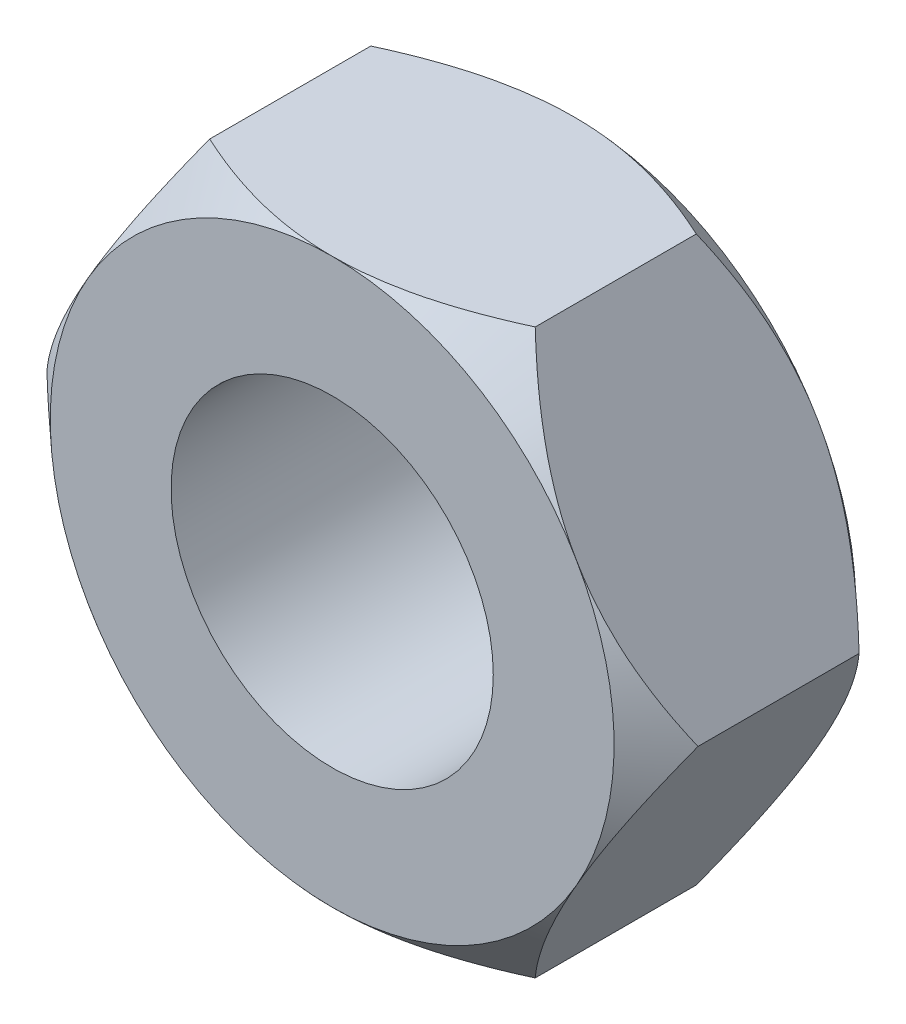
from build123d import *

# Parameters (mm, degrees)
SKETCH1_R           = 2
BOSS_EXTRUDE1_DEPTH = 3


with BuildPart() as part:
    # Sketch1 → Boss-Extrude1 (new body)
    with BuildSketch(Plane.XY):
        Polygon((-4.041451884, 0), (-2.020725942, -3.5), (2.020725942, -3.5), (4.041451884, 0), (2.020725942, 3.5), (-2.020725942, 3.5), align=None)
        Circle(SKETCH1_R, mode=Mode.SUBTRACT)
    extrude(amount=BOSS_EXTRUDE1_DEPTH)

    # Sketch3 → Cut-Revolve1 (revolve, cut)
    with BuildSketch(Plane(origin=(0, 0, 0), x_dir=(1, 0, 0), z_dir=(0, 1, 0))):
        Polygon((4.041451884, -3), (4.041451884, -2.5), (3.5, -3), align=None)
        Polygon((3.5, 0), (4.041451884, 0), (4.041451884, -0.5), align=None)
    revolve(axis=Axis((0, 0, 0), (0, 0, 1)), mode=Mode.SUBTRACT)


solid = part.part
